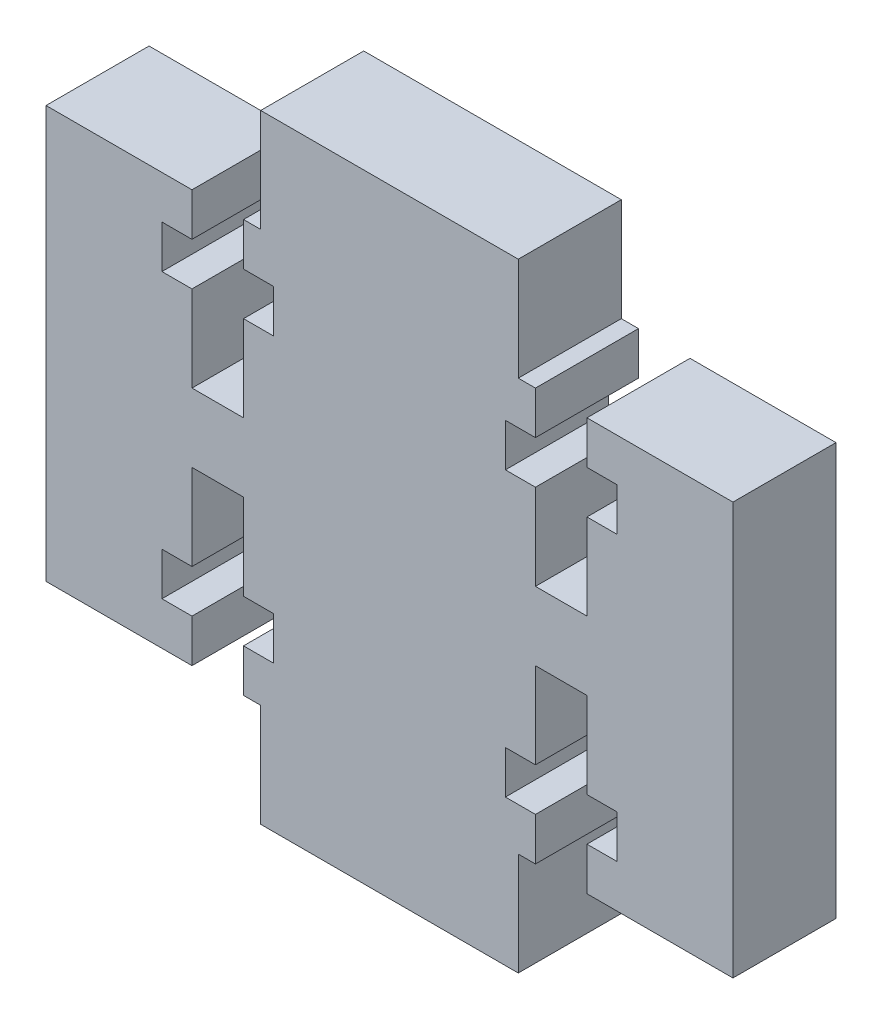
from build123d import *

# Parameters (mm, degrees)
BOSS_EXTRUDE1_DEPTH = 6


with BuildPart() as part:
    # Sketch1 → Boss-Extrude1 (new body)
    with BuildSketch(Plane.XY):
        Polygon((-11.5, 9.5), (-11.5, 12), (-20, 12), (-20, -12), (-11.5, -12), (-11.5, -9.5), (-13.25, -9.5), (-13.25, -7), (-11.5, -7), (-11.5, -2), (-8.5, -2), (-8.5, -7), (-6.75, -7), (-6.75, -9.5), (-8.5, -9.5), (-8.5, -12), (-7.5, -12), (-7.5, -18), (7.5, -18), (7.5, -12), (8.5, -12), (8.5, -9.5), (6.75, -9.5), (6.75, -7), (8.5, -7), (8.5, -2), (11.5, -2), (11.5, -7), (13.25, -7), (13.25, -9.5), (11.5, -9.5), (11.5, -12), (20, -12), (20, 12), (11.5, 12), (11.5, 9.5), (13.25, 9.5), (13.25, 7), (11.5, 7), (11.5, 2), (8.5, 2), (8.5, 7), (6.75, 7), (6.75, 9.5), (8.5, 9.5), (8.5, 12), (7.5, 12), (7.5, 18), (-7.5, 18), (-7.5, 12), (-8.5, 12), (-8.5, 9.5), (-6.75, 9.5), (-6.75, 7), (-8.5, 7), (-8.5, 2), (-11.5, 2), (-11.5, 7), (-13.25, 7), (-13.25, 9.5), align=None)
    extrude(amount=BOSS_EXTRUDE1_DEPTH)


solid = part.part
